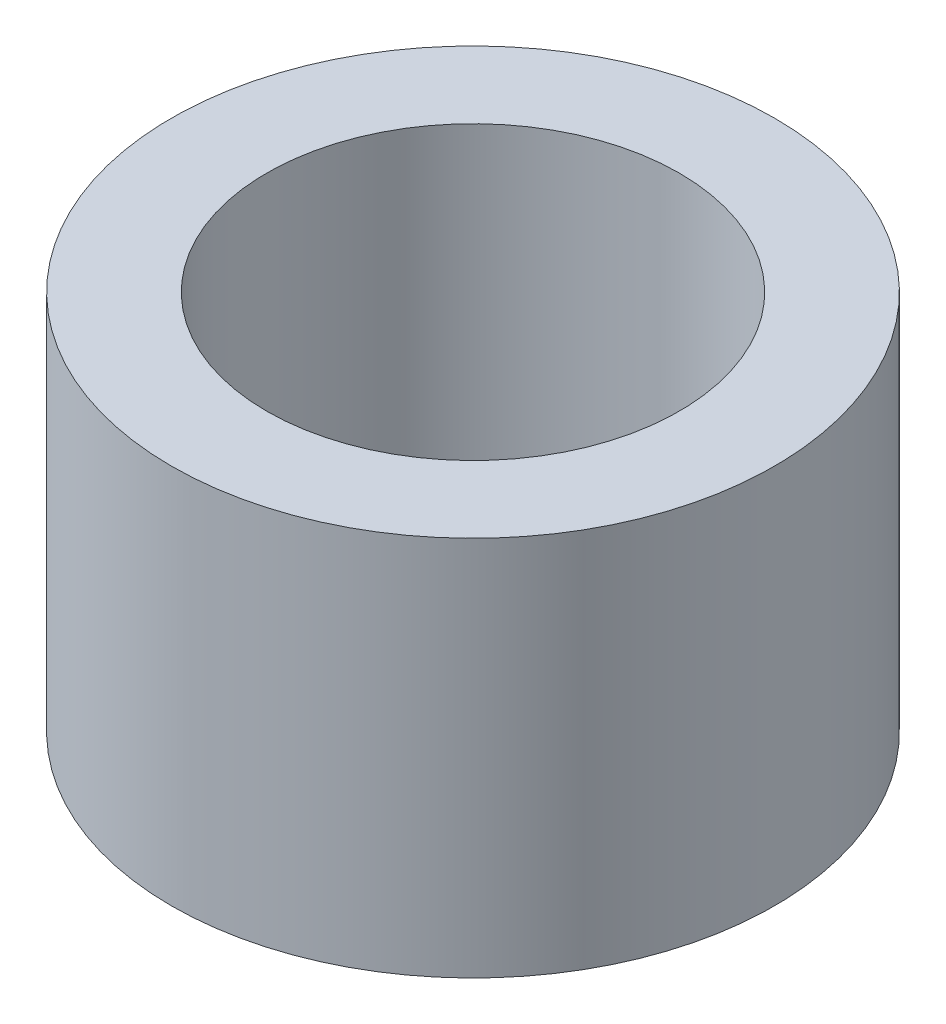
from build123d import *

# Parameters (mm, degrees)
SKETCH1_R           = 4.75
SKETCH1_R_2         = 3.25
BOSS_EXTRUDE1_DEPTH = 6


with BuildPart() as part:
    # Sketch1 → Boss-Extrude1 (new body)
    with BuildSketch(Plane(origin=(0, 0, 0), x_dir=(1, 0, 0), z_dir=(0, 1, 0))):
        with Locations(Location((0, 0, 0), (0, 0, 270))):
            Circle(SKETCH1_R)
        with Locations(Location((0, 0, 0), (0, 0, 270))):
            Circle(SKETCH1_R_2, mode=Mode.SUBTRACT)
    extrude(amount=BOSS_EXTRUDE1_DEPTH)


solid = part.part
